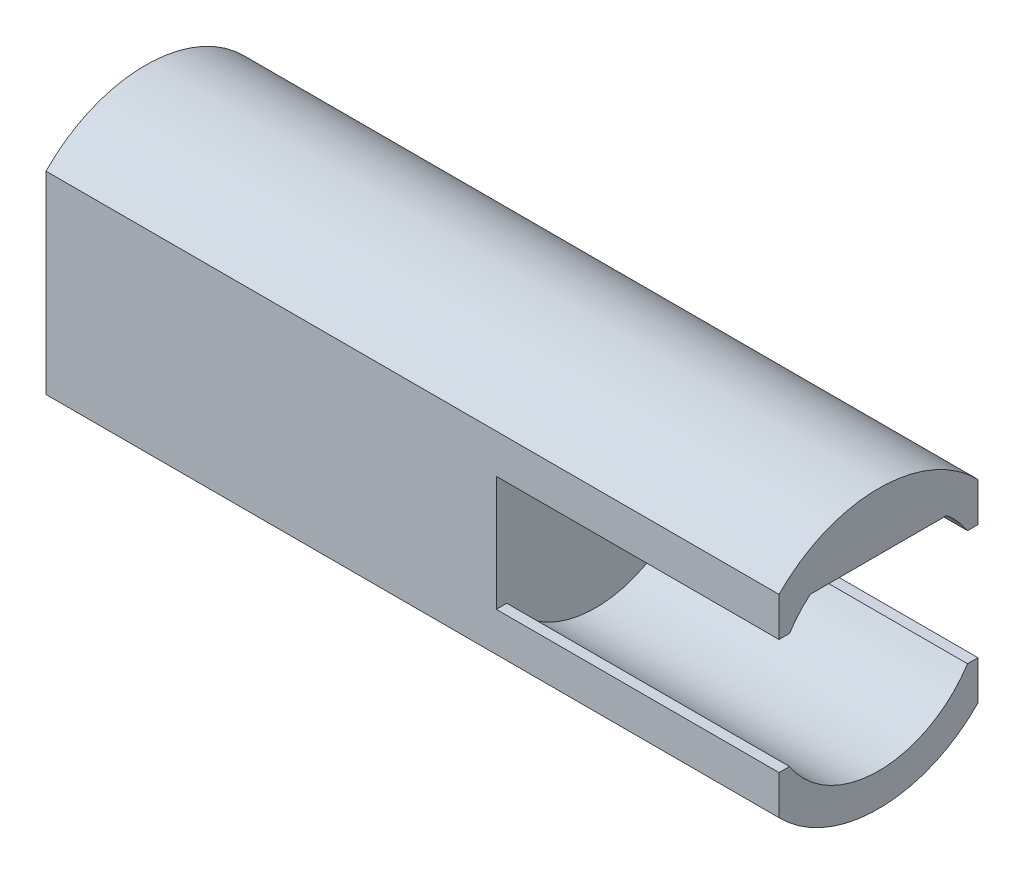
from build123d import *

# Parameters (mm, degrees)
BOSS_EXTRUDE1_DEPTH   = 5.4
BOSS_EXTRUDE1_2_DEPTH = 5.4
BOSS_EXTRUDE2_START   = 8.6
BOSS_EXTRUDE2_DEPTH   = 8.6


with BuildPart() as part:
    # Sketch2 → Boss-Extrude1 (new body)
    with BuildSketch(Plane(origin=(0, 0, 0), x_dir=(0, 0, -1), z_dir=(1, 0, 0))):
        with BuildLine():
            Line((-1.9, -1.84729532), (-1.9, -1.100284054))
            Line((-1.9, -1.100284054), (-1.7, -1.100284054))
            ThreePointArc((-1.7, -1.100284054), (0, -2.025), (1.7, -1.100284054))
            Line((1.7, -1.100284054), (1.9, -1.100284054))
            Line((1.9, -1.100284054), (1.9, -1.84729532))
            ThreePointArc((1.9, -1.84729532), (0, -2.65), (-1.9, -1.84729532))
        make_face()
    extrude(amount=BOSS_EXTRUDE1_DEPTH)



with BuildPart() as body_2:
    # Sketch2 → Boss-Extrude1 2 (new body)
    with BuildSketch(Plane(origin=(0, 0, 0), x_dir=(0, 0, -1), z_dir=(1, 0, 0))):
        with BuildLine():
            Line((-1.9, 1.84729532), (-1.9, 1.100284054))
            Line((-1.9, 1.100284054), (-1.7, 1.100284054))
            ThreePointArc((-1.7, 1.100284054), (-1.518303469, 1.33991775), (-1.303121253, 1.55))
            Line((-1.303121253, 1.55), (1.303121253, 1.55))
            ThreePointArc((1.303121253, 1.55), (1.518303469, 1.33991775), (1.7, 1.100284054))
            Line((1.7, 1.100284054), (1.9, 1.100284054))
            Line((1.9, 1.100284054), (1.9, 1.84729532))
            ThreePointArc((1.9, 1.84729532), (0, 2.65), (-1.9, 1.84729532))
        make_face()
    extrude(amount=BOSS_EXTRUDE1_2_DEPTH)


with BuildPart() as part_1:
    add(part.part)

    add(body_2.part)  # Boss-Extrude2 merges body 2
    # Sketch3 → Boss-Extrude2 (add)
    with BuildSketch(Plane.ZY.offset(BOSS_EXTRUDE2_START)):
        with BuildLine():
            Line((1.9, -1.84729532), (1.9, 1.84729532))
            ThreePointArc((1.9, 1.84729532), (0, 2.65), (-1.9, 1.84729532))
            Line((-1.9, 1.84729532), (-1.9, -1.84729532))
            ThreePointArc((-1.9, -1.84729532), (0, -2.65), (1.9, -1.84729532))
        make_face()
    extrude(amount=-BOSS_EXTRUDE2_DEPTH)


solid = part_1.part
